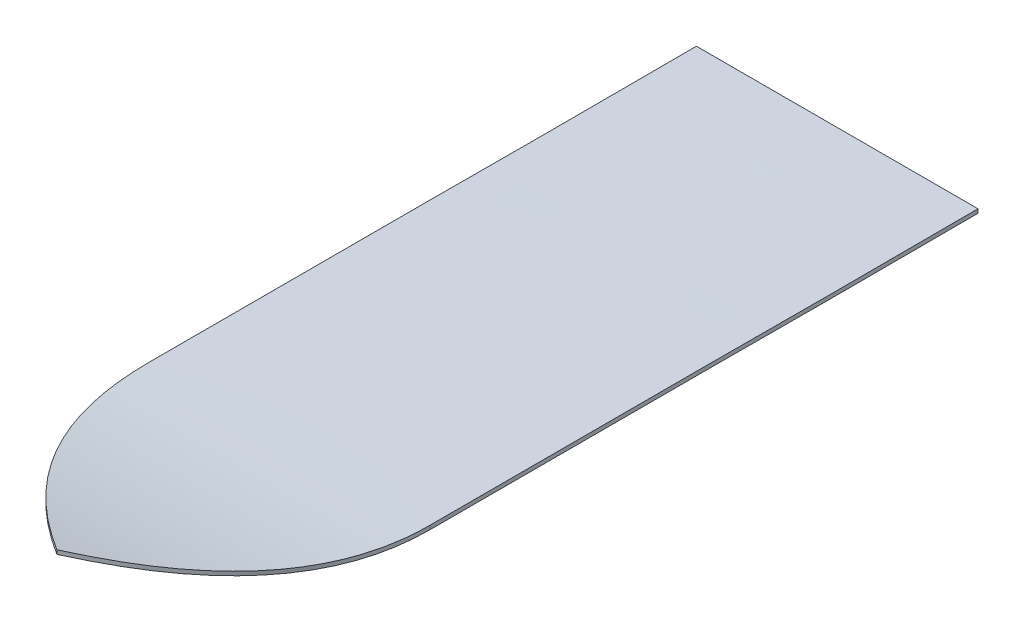
from build123d import *

# Parameters (mm, degrees)
BOSS_EXTRUDE1_DEPTH      = 1524
BOSS_EXTRUDE1_DEPTH_BACK = 1524
CUT_EXTRUDE1_DEPTH       = 3996.786329105
CUT_EXTRUDE1_DEPTH_BACK  = 3996.786329105
SKETCH3_W                = 5731.45735109
SKETCH3_H                = 8003.30588206


with BuildPart() as part:
    # Sketch1 → Boss-Extrude1 (new, two sides: drawn at the far end of the back side and taken through both)
    with BuildSketch(Plane(origin=(0, 0, 0), x_dir=(0, 0, -1), z_dir=(1, 0, 0)).offset(-BOSS_EXTRUDE1_DEPTH_BACK)):
        with BuildLine():
            Line((-1314.669861863, -205.187307578), (-1320.121101735, -229.585749821))
            add(Edge.make_bspline(
                [(-1320.121101735, -229.585749821), (-1308.447293549, -232.193978986), (-1285.113301562, -237.401820459), (-1238.307126307, -247.755619506), (-1179.5331793, -260.456579215), (-1108.230045682, -274.948328217), (-1036.093388823, -288.35187053), (-963.274537089, -300.791877486), (-865.372378356, -316.226566376), (-741.483466722, -333.584389949), (-590.143820576, -350.94231278), (-436.255449789, -364.943868191), (-279.770774353, -375.556092922), (-147.21793662, -381.584701089), (-39.882427014, -384.71772669), (27.738372555, -385.972354836), (82.162336948, -386.553229291), (116.301863312, -386.741869719), (143.721918545, -386.781634685), (171.082675071, -386.766856697), (205.262561913, -386.766851333), (246.289823635, -386.760318844), (300.988944524, -386.753774359), (396.714400997, -386.741063259), (533.46446639, -386.72293233), (697.565197544, -386.70051647), (861.665751559, -386.678213856), (1025.766338287, -386.65590563), (1189.866920458, -386.633597317), (1353.967502363, -386.61128646), (1518.068098781, -386.588972884), (1682.168801654, -386.56628169), (1818.919247802, -386.546819402), (1928.319445081, -386.531950131), (1996.694493936, -386.523198231), (2051.394555864, -386.516554151), (2092.419441774, -386.512028534), (2126.607300874, -386.507827399), (2150.53505135, -386.50723384), (2164.208107013, -386.508106515), (2174.460052831, -386.510016831), (2183.01786371, -386.510587164), (2189.873415125, -386.506232628), (2194.160965103, -386.501320406), (2197.595499085, -386.494408597), (2200.06644687, -386.49294148), (2202.442388225, -386.506134634), (2204.94000728, -386.533127555), (2207.53020348, -386.56205432), (2210.960777786, -386.596857759), (2216.953978804, -386.652214283), (2225.451837401, -386.722729877), (2239.015587952, -386.836705551), (2262.655402434, -387.030312713), (2296.1588551, -387.28569524), (2349.204047778, -387.646364444), (2414.521830402, -388.013275935), (2491.492481757, -388.330868009), (2567.226633308, -388.537723652), (2666.788336049, -388.681575438), (2789.014834735, -388.643388257), (2933.526523587, -388.343739089), (3053.276431498, -387.959548486), (3149.442543383, -387.622360997), (3245.824401019, -387.267922757), (3343.176663484, -386.926770152), (3442.993102528, -386.686091024), (3519.095180652, -386.558494698), (3583.155112212, -386.479091291), (3634.600983815, -386.424016572), (3660.362359145, -386.39784135), (3673.238242049, -386.38476046)],
                knots=[0.002527185, 0.002527185, 0.002527185, 0.002527185, 0.010319941, 0.018112698, 0.03369821, 0.049283723, 0.064869236, 0.080454749, 0.096040261, 0.127211287, 0.158382312, 0.189553338, 0.220724363, 0.251895389, 0.267480901, 0.283066414, 0.290859171, 0.298651927, 0.302548305, 0.306444683, 0.31423744, 0.322030196, 0.329822952, 0.345408465, 0.376579491, 0.407750516, 0.438921542, 0.470092567, 0.501263592, 0.532434618, 0.563605643, 0.594776669, 0.625947694, 0.641533207, 0.65711872, 0.664911476, 0.672704233, 0.680496989, 0.684393367, 0.686341556, 0.688289745, 0.690237934, 0.691212029, 0.692186123, 0.692673171, 0.693160218, 0.693647265, 0.694134313, 0.69462136, 0.695108407, 0.696082502, 0.698030691, 0.69997888, 0.703875258, 0.711668014, 0.719460771, 0.735046283, 0.750631796, 0.766217309, 0.781802822, 0.812973847, 0.844144873, 0.875315898, 0.890901411, 0.906486924, 0.937657949, 0.953243462, 0.968828975, 0.984414487, 0.992207244, 1, 1, 1, 1], degree=3))
            Line((3673.238242049, -386.38476046), (3673.212844018, -361.384773361))
            add(Edge.make_bspline(
                [(-1314.669861863, -205.187307578), (-1248.30401197, -220.015146318), (-1111.666740731, -250.355625155), (-921.886755076, -282.885194848), (-748.9200264, -307.425517403), (-597.98953582, -324.997944647), (-444.462152927, -339.207184113), (-281.81143129, -350.477610437), (-109.648308502, -358.305356008), (21.862470696, -361.082943934), (103.649330872, -361.682149642), (127.575888288, -361.763598875), (144.700894886, -361.776956137), (165.2680742, -361.770746489), (264.662453291, -361.758416572), (442.887687888, -361.73523192), (717.081671918, -361.697859649), (1018.694961834, -361.656869967), (1347.727657272, -361.612133838), (1711.034591861, -361.562739742), (1985.228447529, -361.522744809), (2158.313475834, -361.504946145), (2189.159195195, -361.513320239), (2201.157042157, -361.487073711), (2209.717391916, -361.589021723), (2230.202635562, -361.762811395), (2299.654502148, -362.339544183), (2415.198206017, -363.070010416), (2539.467844961, -363.494700165), (2639.288326023, -363.643418739), (2713.256760518, -363.666967197), (2786.503416181, -363.614401997), (2859.203825334, -363.497619401), (2931.532084002, -363.328443367), (3003.667648542, -363.118967694), (3075.769970284, -362.880279124), (3208.325818715, -362.416342502), (3402.072397479, -361.660230847), (3582.832695171, -361.476592523), (3673.212844018, -361.384773361)],
                knots=[0.002527185, 0.002527185, 0.002527185, 0.002527185, 0.046875, 0.09375, 0.125, 0.15625, 0.1875, 0.21875, 0.25390625, 0.2890625, 0.294921875, 0.30078125, 0.302734375, 0.3046875, 0.3125, 0.359375, 0.40625, 0.46875, 0.53125, 0.59375, 0.67578125, 0.6875, 0.692382812, 0.693359375, 0.694335938, 0.697265625, 0.705078125, 0.734375, 0.765625, 0.78125, 0.796875, 0.8125, 0.828125, 0.84375, 0.859375, 0.875, 0.890625, 0.9453125, 1, 1, 1, 1], degree=3))
        make_face()
    extrude(amount=BOSS_EXTRUDE1_DEPTH + BOSS_EXTRUDE1_DEPTH_BACK)

    # Sketch3 → Cut-Extrude1 (cut, two sides: drawn at the far end of the back side and taken through both)
    with BuildSketch(Plane(origin=(0, 0, 0), x_dir=(1, 0, 0), z_dir=(0, 1, 0)).offset(-CUT_EXTRUDE1_DEPTH_BACK)):
        with Locations((-17.982613003, 2365.757827075)):
            Rectangle(SKETCH3_W, SKETCH3_H)
        with BuildLine():
            Line((-900, 3691.027293144), (900, 3691.027293144))
            Line((900, 3691.027293144), (900, 173.493642592))
            add(Edge.make_bspline(
                [(900, 173.493642592), (900, -701.144962591), (0, -1314.669861863)],
                knots=[0, 0, 0, 1, 1, 1], degree=2))
            add(Edge.make_bspline(
                [(-900, 173.493642592), (-900, -701.144962591), (0, -1314.669861863)],
                knots=[0, 0, 0, 1, 1, 1], degree=2))
            Line((-900, 173.493642592), (-900, 3691.027293144))
        make_face(mode=Mode.SUBTRACT)
    extrude(amount=CUT_EXTRUDE1_DEPTH + CUT_EXTRUDE1_DEPTH_BACK, mode=Mode.SUBTRACT)


solid = part.part
